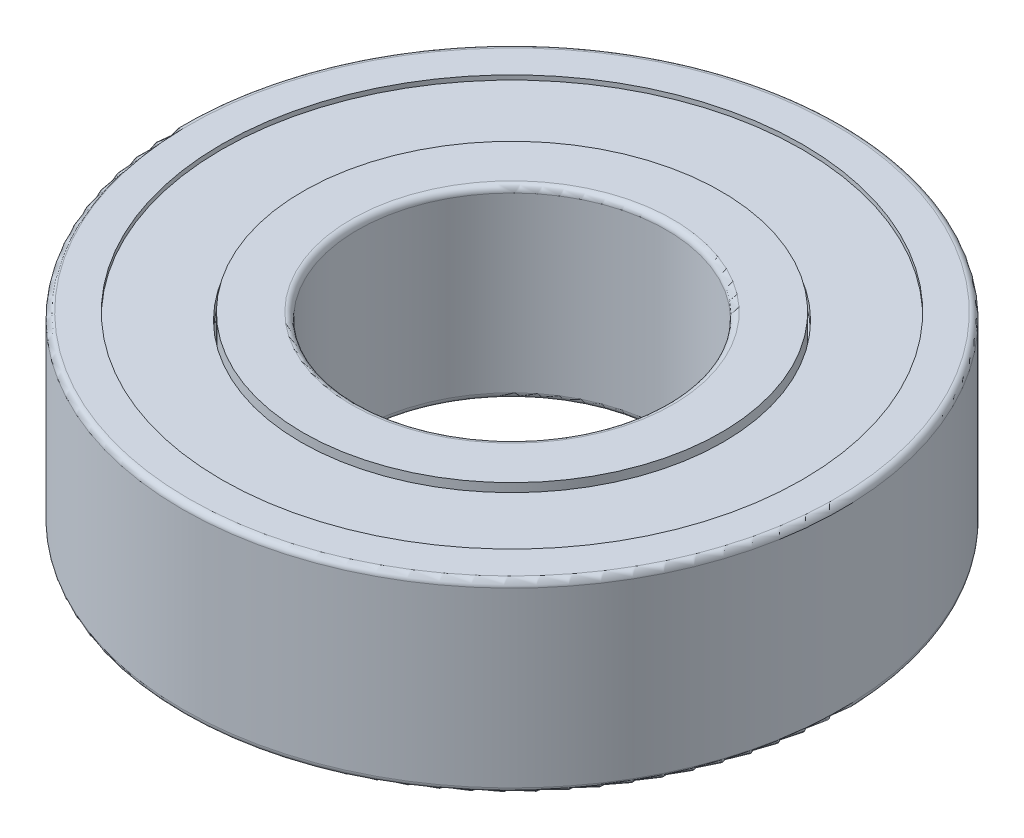
from build123d import *

# Parameters (mm, degrees)
CIRPATTERN1_COUNT   = 9
FILLET1_R           = 0.3
FILLET2_R           = 0.3
SKETCH3_R           = 14.385
SKETCH3_R_2         = 10.25
BOSS_EXTRUDE4_DEPTH = 0.57
SKETCH6_R           = 14.385
SKETCH6_R_2         = 10.25
BOSS_EXTRUDE6_DEPTH = 0.57


with BuildPart() as part:
    # Sketch2 → Revolve1 (revolve)
    with BuildSketch(Plane.XY):
        with BuildLine():
            Line((-11.75, 2.38), (-11.75, -2.38))
            ThreePointArc((-11.75, -2.38), (-9.37, 0), (-11.75, 2.38))
        make_face()
    revolve(axis=Axis((-11.75, 2.38, 0), (0, -1, 0)))


with BuildPart() as body_2:
    # Sketch1 → Revolve2 (revolve)
    with BuildSketch(Plane.XY, mode=Mode.PRIVATE) as revolve2_sk:
        with BuildLine():
            ThreePointArc((-10.15, -1.768678885), (-9.365, 0), (-10.15, 1.768678885))
            Line((-10.15, 1.768678885), (-10.15, 4.5))
            Line((-10.15, 4.5), (-7.5, 4.5))
            Line((-7.5, 4.5), (-7.5, -4.5))
            Line((-7.5, -4.5), (-10.15, -4.5))
            Line((-10.15, -4.5), (-10.15, -1.768678885))
        make_face()
        with BuildLine():
            Line((-14.1, -4.28), (-14.1, -4.5))
            Line((-14.1, -4.5), (-16, -4.5))
            Line((-16, -4.5), (-16, 4.5))
            Line((-16, 4.5), (-14.1, 4.5))
            Line((-14.1, 4.5), (-14.1, 4.28))
            Line((-14.1, 4.28), (-14.38, 4.28))
            ThreePointArc((-14.38, 4.28), (-14.665, 3.995), (-14.38, 3.71))
            Line((-14.38, 3.71), (-13.35, 3.58))
            Line((-13.35, 3.58), (-13.35, 1.768678885))
            ThreePointArc((-13.35, 1.768678885), (-14.135, 0), (-13.35, -1.768678885))
            Line((-13.35, -1.768678885), (-13.35, -3.58))
            Line((-13.35, -3.58), (-14.1, -3.71))
            ThreePointArc((-14.1, -3.71), (-14.385, -3.995), (-14.1, -4.28))
        make_face()
    revolve(revolve2_sk.sketch.rotate(Axis((0, 4.95, 0), (0, -1, 0)), 270), axis=Axis((0, 4.95, 0), (0, -1, 0)))

    # Fillet1
    fillet1_edges = [body_2.edges().sort_by_distance(p)[0] for p in [
        (0, -4.5, -16),
        (0, 4.5, -16),
    ]]
    fillet(fillet1_edges, radius=FILLET1_R)

    # Fillet2
    fillet2_edges = [body_2.edges().sort_by_distance(p)[0] for p in [
        (0, 4.5, -7.5),
        (0, -4.5, -7.5),
    ]]
    fillet(fillet2_edges, radius=FILLET2_R)

    # Sketch3 → Boss-Extrude4 (add)
    with BuildSketch(Plane(origin=(0, 3.58, 0), x_dir=(-1, 0, 0), z_dir=(0, -1, 0))):
        with Locations(Location((0, 0, 0), (0, 0, 90))):
            Circle(SKETCH3_R)
        with Locations(Location((0, 0, 0), (0, 0, 90))):
            Circle(SKETCH3_R_2, mode=Mode.SUBTRACT)
    extrude(amount=-BOSS_EXTRUDE4_DEPTH)

    # Sketch6 → Boss-Extrude6 (add)
    with BuildSketch(Plane(origin=(0, -3.58, 0), x_dir=(-1, 0, 0), z_dir=(0, -1, 0))):
        with Locations(Location((0, 0, 0), (0, 0, 90))):
            Circle(SKETCH6_R)
        with Locations(Location((0, 0, 0), (0, 0, 90))):
            Circle(SKETCH6_R_2, mode=Mode.SUBTRACT)
    extrude(amount=BOSS_EXTRUDE6_DEPTH)


with BuildPart() as cirpattern1_1:
    # CirPattern1: pattern copy
    add(part.part.rotate(Axis((0, 0, 0), (0, 1, 0)), 1 * 360 / CIRPATTERN1_COUNT))


with BuildPart() as cirpattern1_2:
    # CirPattern1: pattern copy
    add(part.part.rotate(Axis((0, 0, 0), (0, 1, 0)), 2 * 360 / CIRPATTERN1_COUNT))


with BuildPart() as cirpattern1_3:
    # CirPattern1: pattern copy
    add(part.part.rotate(Axis((0, 0, 0), (0, 1, 0)), 3 * 360 / CIRPATTERN1_COUNT))


with BuildPart() as cirpattern1_4:
    # CirPattern1: pattern copy
    add(part.part.rotate(Axis((0, 0, 0), (0, 1, 0)), 4 * 360 / CIRPATTERN1_COUNT))


with BuildPart() as cirpattern1_5:
    # CirPattern1: pattern copy
    add(part.part.rotate(Axis((0, 0, 0), (0, 1, 0)), 5 * 360 / CIRPATTERN1_COUNT))


with BuildPart() as cirpattern1_6:
    # CirPattern1: pattern copy
    add(part.part.rotate(Axis((0, 0, 0), (0, 1, 0)), 6 * 360 / CIRPATTERN1_COUNT))


with BuildPart() as cirpattern1_7:
    # CirPattern1: pattern copy
    add(part.part.rotate(Axis((0, 0, 0), (0, 1, 0)), 7 * 360 / CIRPATTERN1_COUNT))


with BuildPart() as cirpattern1_8:
    # CirPattern1: pattern copy
    add(part.part.rotate(Axis((0, 0, 0), (0, 1, 0)), 8 * 360 / CIRPATTERN1_COUNT))


solid = Compound([part.part, body_2.part, cirpattern1_1.part, cirpattern1_2.part, cirpattern1_3.part, cirpattern1_4.part, cirpattern1_5.part, cirpattern1_6.part, cirpattern1_7.part, cirpattern1_8.part])
